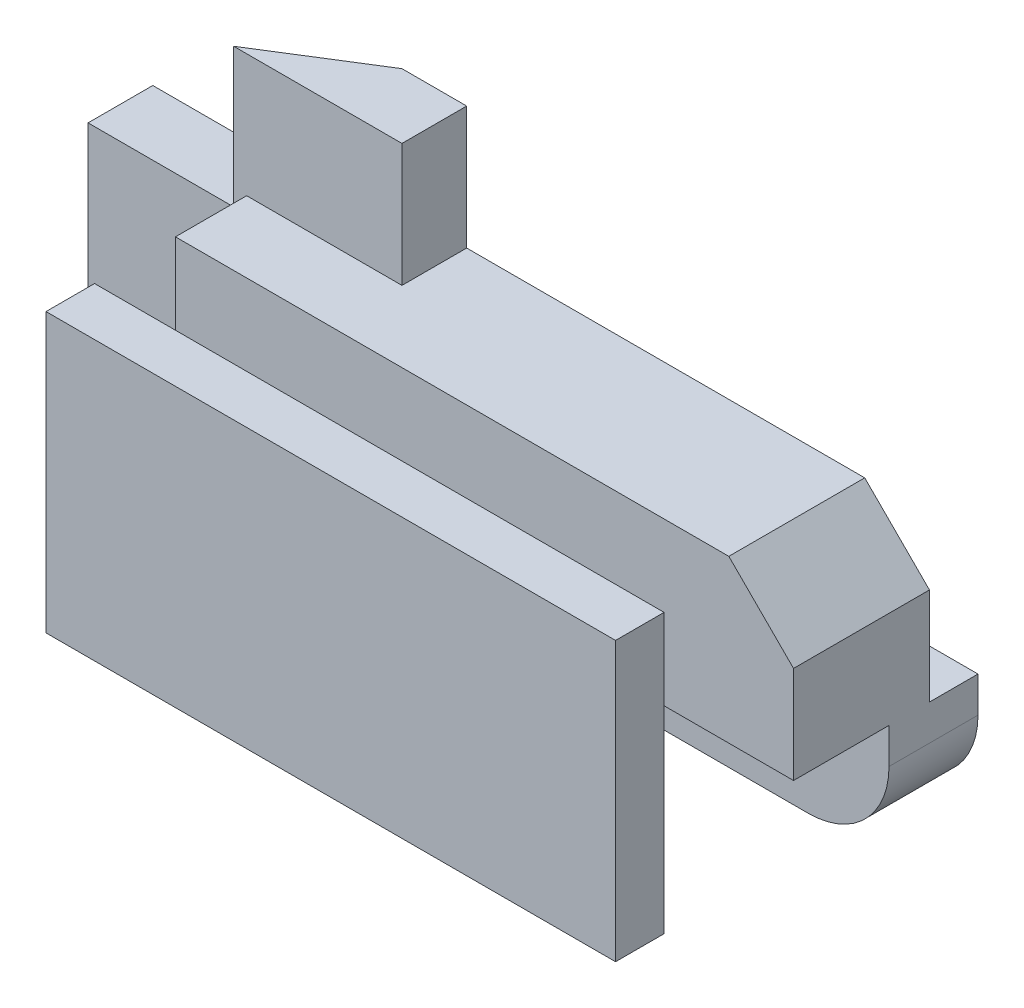
from build123d import *

# Parameters (mm, degrees)
SKETCH_1_W          = 4.5
SKETCH_1_H          = 6
EXTRUDE_1_DEPTH     = 2
SKETCH_2_W          = 19.5
SKETCH_2_H          = 6.5
EXTRUDE_2_DEPTH     = 4.2
SKETCH_4_W          = 10
SKETCH_4_H          = 2.1
EXTRUDE_3_DEPTH     = 4.2
SKETCH_5_W          = 24
SKETCH_5_H          = 3.6
CUT_EXTRUDE_1_DEPTH = 2.95
SKETCH_3_W          = 4.5
SKETCH_3_H          = 3.6
EXTRUDE_4_DEPTH     = 1.5
SKETCH_7_W          = 5.2
SKETCH_7_H          = 3.8
EXTRUDE_5_DEPTH     = 2
CUT_EXTRUDE_2_REACH = 29.339
SKETCH_9_W          = 0.4
SKETCH_9_H          = 5
CUT_EXTRUDE_3_DEPTH = 2.2
FILLET_1_R          = 2.5
CHAMFER_1_SIZE      = 2
SKETCH_10_W         = 9.2
SKETCH_10_H         = 2.5
EXTRUDE_6_DEPTH     = 2.5
SKETCH_11_W         = 17.6
SKETCH_11_H         = 8.6
EXTRUDE_7_DEPTH     = 1.5


with BuildPart() as part:
    # 草图1 → 凸台-拉伸1 (new body)
    with BuildSketch(Plane.XY):
        with Locations((2.25, 3)):
            Rectangle(SKETCH_1_W, SKETCH_1_H)
    extrude(amount=EXTRUDE_1_DEPTH)

    # 草图2 → 凸台-拉伸2 (add)
    with BuildSketch(Plane(origin=(0, 0, 0), x_dir=(-1, 0, 0), z_dir=(0, 0, -1))):
        with Locations((-14.25, 3.25)):
            Rectangle(SKETCH_2_W, SKETCH_2_H)
    extrude(amount=-EXTRUDE_2_DEPTH)

    # 草图4 → 凸台-拉伸3 (add)
    with BuildSketch(Plane(origin=(0, 0, 0), x_dir=(-1, 0, 0), z_dir=(0, 0, -1))):
        with Locations((-19, -1.05)):
            Rectangle(SKETCH_4_W, SKETCH_4_H)
    extrude(amount=-EXTRUDE_3_DEPTH)

    # 草图5 → 切除-拉伸1 (cut)
    with BuildSketch(Plane.XY.offset(4.2)):
        with Locations((12, -0.3)):
            Rectangle(SKETCH_5_W, SKETCH_5_H)
    extrude(amount=-CUT_EXTRUDE_1_DEPTH, mode=Mode.SUBTRACT)

    # 草图3 → 凸台-拉伸4 (add)
    with BuildSketch(Plane(origin=(0, 0, 0), x_dir=(-1, 0, 0), z_dir=(0, 0, -1))):
        with Locations((-21.75, -0.3)):
            Rectangle(SKETCH_3_W, SKETCH_3_H)
    extrude(amount=EXTRUDE_4_DEPTH)

    # 草图7 → 凸台-拉伸5 (add)
    with BuildSketch(Plane(origin=(0, 0, 0), x_dir=(-1, 0, 0), z_dir=(0, 0, -1))):
        with Locations((-7.1, 8.4)):
            Rectangle(SKETCH_7_W, SKETCH_7_H)
    extrude(amount=-EXTRUDE_5_DEPTH)

    # 切除-拉伸2: up to this face of the body (flat: up to its plane)
    cut_extrude_2_end = Plane(part.part.faces().sort_by_distance((2.25, 6, 1))[0])
    # 草图8 → 切除-拉伸2 (cut, up to the picked face)
    with BuildSketch(Plane(origin=(0, 10.3, 0), x_dir=(1, 0, 0), z_dir=(0, 1, 0)), mode=Mode.PRIVATE) as cut_extrude_2_sk1:
        Polygon((4.5, -2), (7.7, 0), (4.5, 0), align=None)
    cut_extrude_2_tool1 = split(extrude(cut_extrude_2_sk1.sketch, amount=-CUT_EXTRUDE_2_REACH, mode=Mode.PRIVATE), bisect_by=cut_extrude_2_end, keep=Keep.BOTH, mode=Mode.PRIVATE)
    add(cut_extrude_2_tool1.solids().sort_by(Axis((5.566667, 10.3, 0.666667), (0, -1, 0)))[0], mode=Mode.SUBTRACT)

    # 草图9 → 切除-拉伸3 (cut)
    with BuildSketch(Plane.XY.offset(4.2)):
        with Locations((4.7, 4)):
            Rectangle(SKETCH_9_W, SKETCH_9_H)
    extrude(amount=-CUT_EXTRUDE_3_DEPTH, mode=Mode.SUBTRACT)

    # 圆角1
    fillet_1_edges = [part.edges().sort_by_distance(p)[0] for p in [
        (24, -2.1, -0.125),
    ]]
    fillet(fillet_1_edges, radius=FILLET_1_R)

    # 倒角1
    chamfer_1_edges = [part.edges().sort_by_distance(p)[0] for p in [
        (24, 6.5, 2.1),
    ]]
    chamfer(chamfer_1_edges, length=CHAMFER_1_SIZE)

    # 草图10 → 凸台-拉伸6 (add)
    with BuildSketch(Plane.XY.offset(4.2)):
        with Locations((12.34, 2.75)):
            Rectangle(SKETCH_10_W, SKETCH_10_H)
    extrude(amount=EXTRUDE_6_DEPTH)

    # 草图11 → 凸台-拉伸7 (add)
    with BuildSketch(Plane.XY.offset(6.7)):
        with Locations((13.7, 2.2)):
            Rectangle(SKETCH_11_W, SKETCH_11_H)
    extrude(amount=EXTRUDE_7_DEPTH)


solid = part.part
